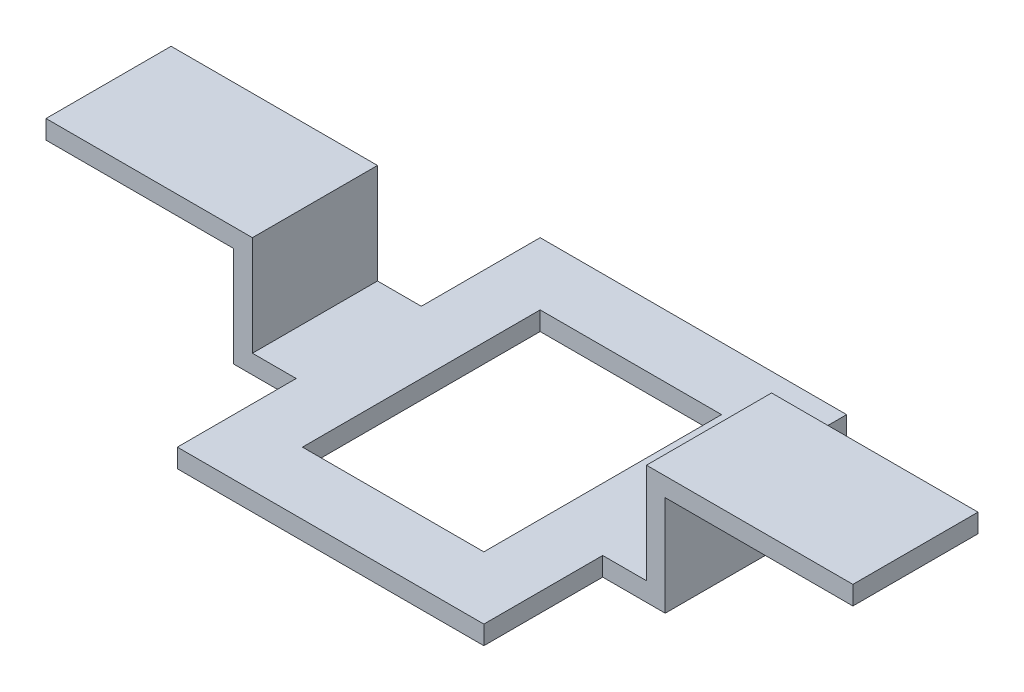
from build123d import *

# Parameters (mm, degrees)
SKETCH2_W           = 49
SKETCH2_H           = 58
BOSS_EXTRUDE1_DEPTH = 3
SKETCH3_W           = 29
SKETCH3_H           = 38
CUT_EXTRUDE1_DEPTH  = 3
SKETCH4_W           = 20
SKETCH4_H           = 3
BOSS_EXTRUDE2_DEPTH = 10
SKETCH5_W           = 3
SKETCH5_H           = 20
BOSS_EXTRUDE3_DEPTH = 16
SKETCH7_W           = 20
SKETCH7_H           = 3
BOSS_EXTRUDE4_DEPTH = 30


with BuildPart() as part:
    # Sketch2 → Boss-Extrude1 (new body)
    with BuildSketch(Plane(origin=(0, 0, 0), x_dir=(1, 0, 0), z_dir=(0, 1, 0))):
        Rectangle(SKETCH2_W, SKETCH2_H)
    extrude(amount=BOSS_EXTRUDE1_DEPTH)

    # Sketch3 → Cut-Extrude1 (cut)
    with BuildSketch(Plane(origin=(0, 3, 0), x_dir=(1, 0, 0), z_dir=(0, 1, 0))):
        Rectangle(SKETCH3_W, SKETCH3_H)
    extrude(amount=-CUT_EXTRUDE1_DEPTH, mode=Mode.SUBTRACT)

    # Sketch4 → Boss-Extrude2 (add)
    with BuildSketch(Plane.ZY.offset(24.5)):
        with Locations((0, 1.5)):
            Rectangle(SKETCH4_W, SKETCH4_H)
    boss_extrude2 = extrude(amount=BOSS_EXTRUDE2_DEPTH)

    # Sketch5 → Boss-Extrude3 (add)
    with BuildSketch(Plane(origin=(0, 3, 0), x_dir=(1, 0, 0), z_dir=(0, 1, 0))):
        with Locations((-33, 0)):
            Rectangle(SKETCH5_W, SKETCH5_H)
    boss_extrude3 = extrude(amount=BOSS_EXTRUDE3_DEPTH)

    # Sketch7 → Boss-Extrude4 (add)
    with BuildSketch(Plane.ZY.offset(34.5)):
        with Locations((0, 17.5)):
            Rectangle(SKETCH7_W, SKETCH7_H)
    boss_extrude4 = extrude(amount=BOSS_EXTRUDE4_DEPTH)

    # Mirror1: Boss-Extrude2, Boss-Extrude3, Boss-Extrude4 across plane
    add(boss_extrude2.mirror(Plane(origin=(0, 0, 0), x_dir=(0, 0, 1), z_dir=(1, 0, 0))))
    add(boss_extrude3.mirror(Plane(origin=(0, 0, 0), x_dir=(0, 0, 1), z_dir=(1, 0, 0))))
    add(boss_extrude4.mirror(Plane(origin=(0, 0, 0), x_dir=(0, 0, 1), z_dir=(1, 0, 0))))


solid = part.part
